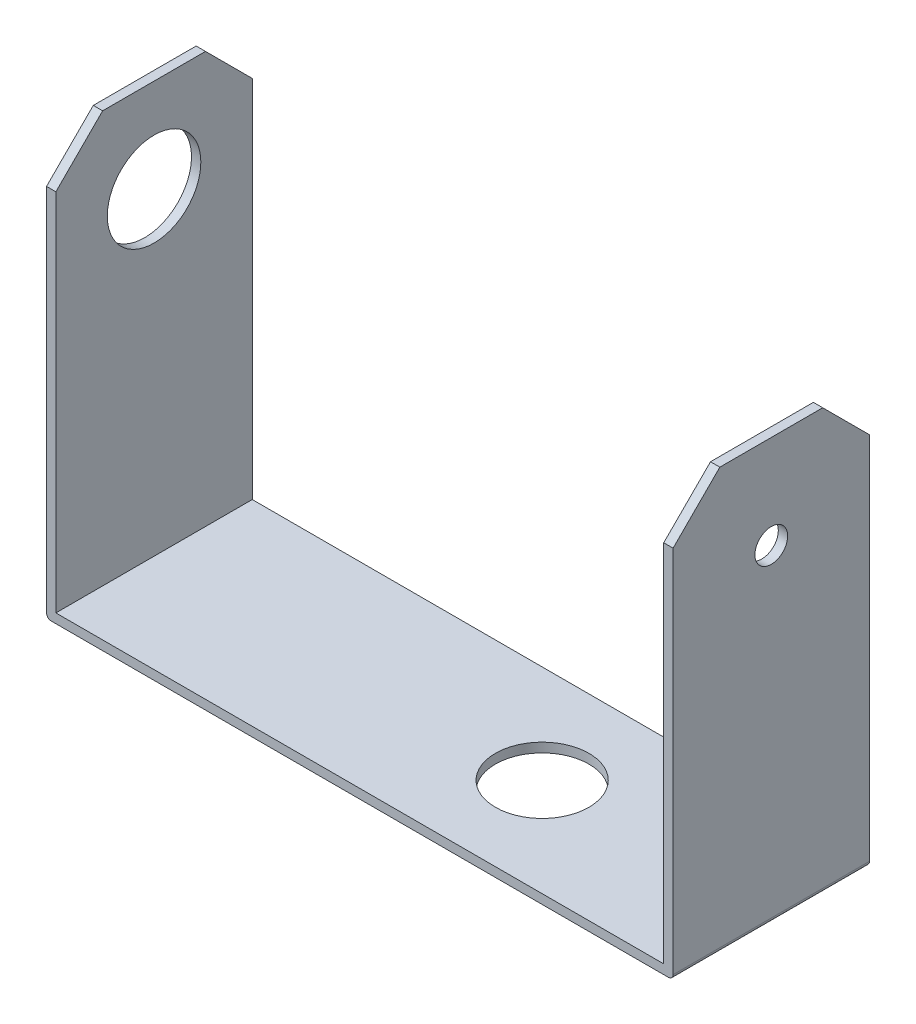
from build123d import *

# Parameters (mm, degrees)
SKETCH_1_W                  = 67
SKETCH_1_H                  = 21
EXTRUDE_1_DEPTH             = 45
SHELL_1_T                   = -1
FILLET_1_R                  = 0.5
CHAMFER_1_SIZE              = 5
HOLE_WIZARD_10_0_10_1_D     = 10
HOLE_WIZARD_10_0_10_1_DEPTH = 1
HOLE_WIZARD_10_0_10_2_D     = 10
HOLE_WIZARD_3_5_3_5_1_D     = 3.5


with BuildPart() as part:
    # 草图1 → 凸台-拉伸1 (new body)
    with BuildSketch(Plane(origin=(0, 0, 0), x_dir=(1, 0, 0), z_dir=(0, 1, 0))):
        with Locations((-33.5, 10.5)):
            Rectangle(SKETCH_1_W, SKETCH_1_H)
    extrude(amount=EXTRUDE_1_DEPTH)

    # 抽壳1
    shell_1_openings = [part.faces().sort_by_distance(p)[0] for p in [
        (-33.5, 45, -10.5),
        (-33.5, 22.5, 0),
        (-33.5, 22.5, -21),
    ]]
    offset(amount=SHELL_1_T, openings=shell_1_openings, kind=Kind.INTERSECTION)

    # 圆角1
    fillet_1_edges = [part.edges().sort_by_distance(p)[0] for p in [
        (-67, 0, -10.5),
        (0, 0, -10.5),
    ]]
    fillet(fillet_1_edges, radius=FILLET_1_R)

    # 倒角1
    chamfer_1_edges = [part.edges().sort_by_distance(p)[0] for p in [
        (-66.5, 45, 0),
        (-66.5, 45, -21),
        (-0.5, 45, 0),
        (-0.5, 45, -21),
    ]]
    chamfer(chamfer_1_edges, length=CHAMFER_1_SIZE)

    # Ø10.0 (10) 直径槽口1
    with Locations(Plane.ZY.offset(67)):
        with Locations((-10.5, 35)):
            Hole(HOLE_WIZARD_10_0_10_1_D / 2, depth=HOLE_WIZARD_10_0_10_1_DEPTH)

    # Ø10.0 (10) 直径槽口2 (through all)
    with Locations(Plane(origin=(0, 1, 0), x_dir=(1, 0, 0), z_dir=(0, 1, 0))):
        with Locations((-24.5, 10.5)):
            Hole(HOLE_WIZARD_10_0_10_2_D / 2)

    # Ø3.5 (3.5) 直径槽口1 (through all)
    with Locations(Plane(origin=(0, 0, 0), x_dir=(0, 0, -1), z_dir=(1, 0, 0))):
        with Locations((10.5, 35)):
            Hole(HOLE_WIZARD_3_5_3_5_1_D / 2)


solid = part.part
